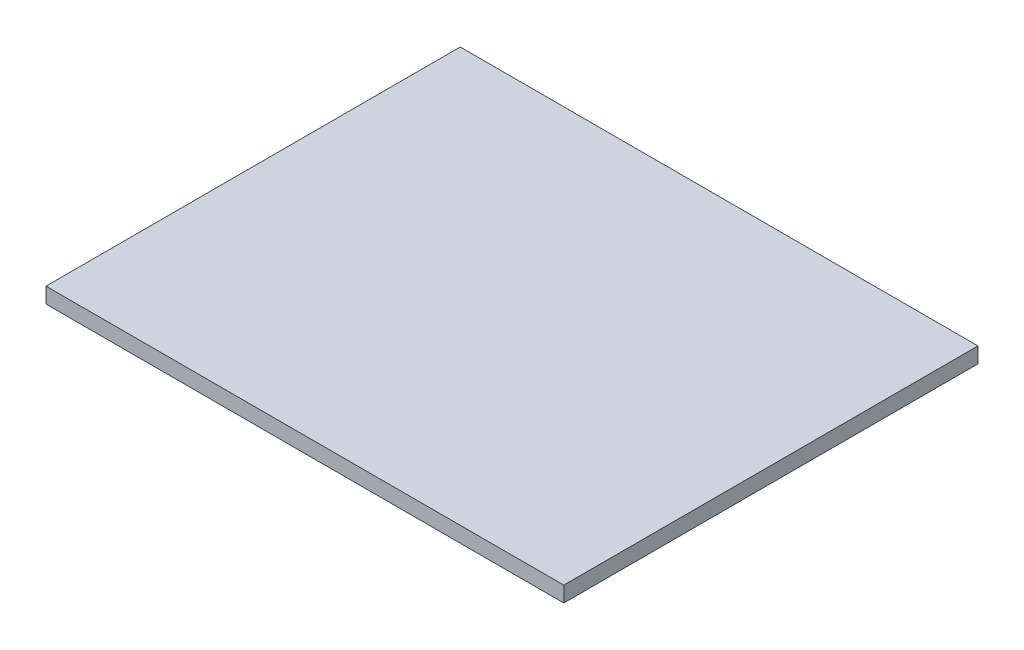
from build123d import *

# Parameters (mm, degrees)
SKETCH_1_W      = 100
SKETCH_1_H      = 80
EXTRUDE_1_DEPTH = 3


with BuildPart() as part:
    # 스케치1 → 보스-돌출1 (new body)
    with BuildSketch(Plane(origin=(0, 0, 0), x_dir=(1, 0, 0), z_dir=(0, 1, 0))):
        with Locations((50, 40)):
            Rectangle(SKETCH_1_W, SKETCH_1_H)
    extrude(amount=EXTRUDE_1_DEPTH)


solid = part.part
